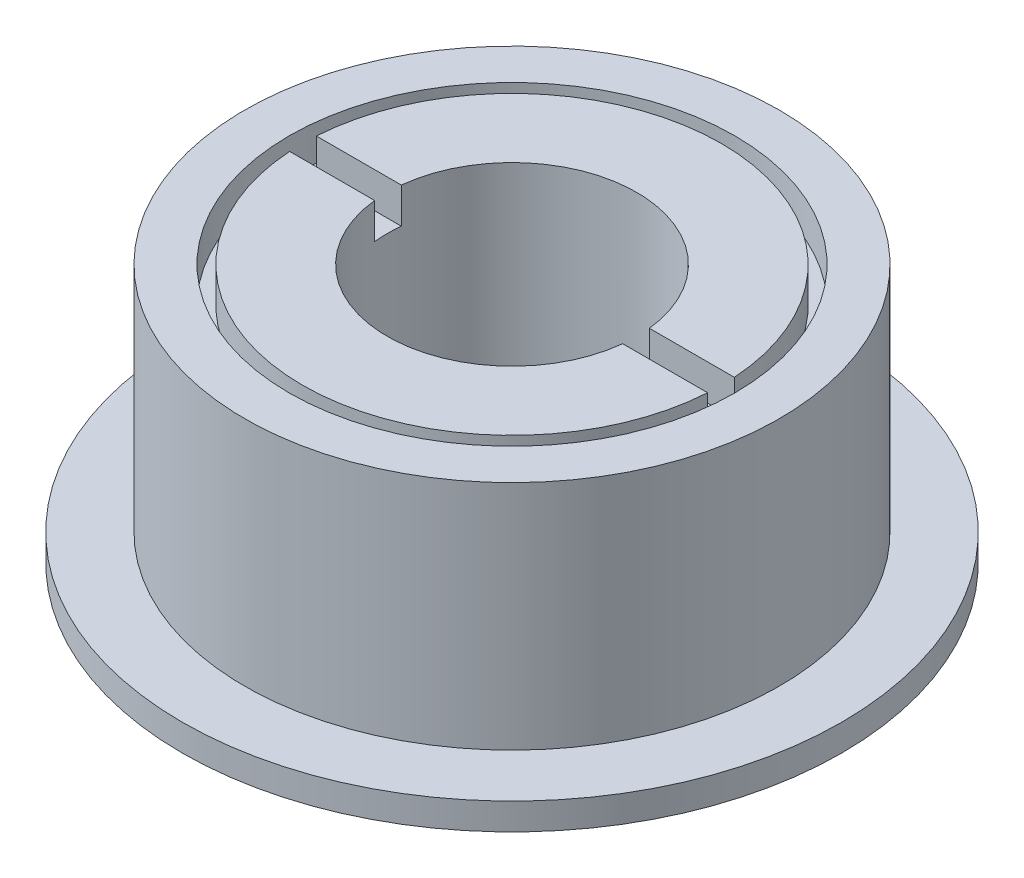
from build123d import *

# Parameters (mm, degrees)
SKETCH1_R           = 37
BOSS_EXTRUDE1_DEPTH = 3
SKETCH1_3_R         = 30
SKETCH1_3_R_2       = 14
BOSS_EXTRUDE2_DEPTH = 29
CUT_EXTRUDE1_START  = -4
SKETCH2_R           = 25
SKETCH2_R_2         = 23.5
CUT_EXTRUDE1_DEPTH  = 4
SKETCH3_R           = 4
SKETCH3_R_2         = 2
CUT_EXTRUDE2_DEPTH  = 4


with BuildPart() as part:
    # Sketch1 → Boss-Extrude1 (new body)
    with BuildSketch(Plane(origin=(0, 0, 0), x_dir=(1, 0, 0), z_dir=(0, 1, 0))):
        with Locations(Location((0, 0, 0), (0, 0, 270))):
            Circle(SKETCH1_R)
    extrude(amount=BOSS_EXTRUDE1_DEPTH)

    # Sketch1<3> → Boss-Extrude2 (add)
    with BuildSketch(Plane(origin=(0, 0, 0), x_dir=(1, 0, 0), z_dir=(0, 1, 0))):
        with Locations(Location((0, 0, 0), (0, 0, 90))):
            Circle(SKETCH1_3_R)
        with Locations(Location((0, 0, 0), (0, 0, 90))):
            Circle(SKETCH1_3_R_2, mode=Mode.SUBTRACT)
    extrude(amount=BOSS_EXTRUDE2_DEPTH)

    # Sketch2 → Cut-Extrude1 (cut)
    # profile 1 of 10: a face of its own
    with BuildSketch(Plane(origin=(0, 29, 0), x_dir=(1, 0, 0), z_dir=(0, 1, 0)).offset(CUT_EXTRUDE1_START)):
        with Locations(Location((0, 0, 0), (0, 0, 270))):
            Circle(SKETCH2_R)
        Circle(SKETCH2_R_2, mode=Mode.SUBTRACT)
    # profile 2 of 10: a face of its own
    with BuildSketch(Plane(origin=(0, 29, 0), x_dir=(1, 0, 0), z_dir=(0, 1, 0)).offset(CUT_EXTRUDE1_START)):
        with BuildLine():
            ThreePointArc((24.954959427, 1.5), (0, 25), (-24.954959427, 1.5))
            Line((-24.954959427, 1.5), (-23.452078799, 1.5))
            ThreePointArc((-23.452078799, 1.5), (0, 23.5), (23.452078799, 1.5))
            Line((23.452078799, 1.5), (24.954959427, 1.5))
        make_face()
    # profile 3 of 10: a face of its own
    with BuildSketch(Plane(origin=(0, 29, 0), x_dir=(1, 0, 0), z_dir=(0, 1, 0)).offset(CUT_EXTRUDE1_START)):
        with BuildLine():
            ThreePointArc((-24.954959427, 1.5), (-25, 0), (-24.954959427, -1.5))
            Line((-24.954959427, -1.5), (-23.452078799, -1.5))
            ThreePointArc((-23.452078799, -1.5), (-23.5, 0), (-23.452078799, 1.5))
            Line((-23.452078799, 1.5), (-24.954959427, 1.5))
        make_face()
    # profile 4 of 10: a face of its own
    with BuildSketch(Plane(origin=(0, 29, 0), x_dir=(1, 0, 0), z_dir=(0, 1, 0)).offset(CUT_EXTRUDE1_START)):
        with BuildLine():
            Line((23.452078799, -1.5), (24.954959427, -1.5))
            ThreePointArc((24.954959427, -1.5), (24.98873732, -0.750338033), (25, 0))
            ThreePointArc((25, 0), (24.98873732, 0.750338033), (24.954959427, 1.5))
            Line((24.954959427, 1.5), (23.452078799, 1.5))
            ThreePointArc((23.452078799, 1.5), (23.488016644, 0.750382643), (23.5, 0))
            ThreePointArc((23.5, 0), (23.488016644, -0.750382643), (23.452078799, -1.5))
        make_face()
    # profile 5 of 10: a face of its own
    with BuildSketch(Plane(origin=(0, 29, 0), x_dir=(1, 0, 0), z_dir=(0, 1, 0)).offset(CUT_EXTRUDE1_START)):
        with BuildLine():
            ThreePointArc((-23.452078799, 1.5), (-23.5, 0), (-23.452078799, -1.5))
            Line((-23.452078799, -1.5), (-13.919410907, -1.5))
            ThreePointArc((-13.919410907, -1.5), (-14, 0), (-13.919410907, 1.5))
            Line((-13.919410907, 1.5), (-23.452078799, 1.5))
        make_face()
    # profile 6 of 10: a face of its own
    with BuildSketch(Plane(origin=(0, 29, 0), x_dir=(1, 0, 0), z_dir=(0, 1, 0)).offset(CUT_EXTRUDE1_START)):
        with BuildLine():
            Line((13.919410907, -1.5), (23.452078799, -1.5))
            ThreePointArc((23.452078799, -1.5), (23.488016644, -0.750382643), (23.5, 0))
            ThreePointArc((23.5, 0), (23.488016644, 0.750382643), (23.452078799, 1.5))
            Line((23.452078799, 1.5), (13.919410907, 1.5))
            ThreePointArc((13.919410907, 1.5), (13.979838209, 0.751081654), (14, 0))
            ThreePointArc((14, 0), (13.979838209, -0.751081654), (13.919410907, -1.5))
        make_face()
    # profile 7 of 10: a face of its own
    with BuildSketch(Plane(origin=(0, 29, 0), x_dir=(1, 0, 0), z_dir=(0, 1, 0)).offset(CUT_EXTRUDE1_START)):
        with BuildLine():
            ThreePointArc((-23.452078799, 1.5), (-23.5, 0), (-23.452078799, -1.5))
            Line((-23.452078799, -1.5), (-13.919410907, -1.5))
            ThreePointArc((-13.919410907, -1.5), (-14, 0), (-13.919410907, 1.5))
            Line((-13.919410907, 1.5), (-23.452078799, 1.5))
        make_face()
    # profile 8 of 10: a face of its own
    with BuildSketch(Plane(origin=(0, 29, 0), x_dir=(1, 0, 0), z_dir=(0, 1, 0)).offset(CUT_EXTRUDE1_START)):
        with BuildLine():
            Line((13.919410907, -1.5), (23.452078799, -1.5))
            ThreePointArc((23.452078799, -1.5), (23.488016644, -0.750382643), (23.5, 0))
            ThreePointArc((23.5, 0), (23.488016644, 0.750382643), (23.452078799, 1.5))
            Line((23.452078799, 1.5), (13.919410907, 1.5))
            ThreePointArc((13.919410907, 1.5), (13.979838209, 0.751081654), (14, 0))
            ThreePointArc((14, 0), (13.979838209, -0.751081654), (13.919410907, -1.5))
        make_face()
    # profile 9 of 10: a face of its own
    with BuildSketch(Plane(origin=(0, 29, 0), x_dir=(1, 0, 0), z_dir=(0, 1, 0)).offset(CUT_EXTRUDE1_START)):
        with BuildLine():
            ThreePointArc((-24.954959427, 1.5), (-25, 0), (-24.954959427, -1.5))
            Line((-24.954959427, -1.5), (-23.452078799, -1.5))
            ThreePointArc((-23.452078799, -1.5), (-23.5, 0), (-23.452078799, 1.5))
            Line((-23.452078799, 1.5), (-24.954959427, 1.5))
        make_face()
    # profile 10 of 10: a face of its own
    with BuildSketch(Plane(origin=(0, 29, 0), x_dir=(1, 0, 0), z_dir=(0, 1, 0)).offset(CUT_EXTRUDE1_START)):
        with BuildLine():
            Line((23.452078799, -1.5), (24.954959427, -1.5))
            ThreePointArc((24.954959427, -1.5), (24.98873732, -0.750338033), (25, 0))
            ThreePointArc((25, 0), (24.98873732, 0.750338033), (24.954959427, 1.5))
            Line((24.954959427, 1.5), (23.452078799, 1.5))
            ThreePointArc((23.452078799, 1.5), (23.488016644, 0.750382643), (23.5, 0))
            ThreePointArc((23.5, 0), (23.488016644, -0.750382643), (23.452078799, -1.5))
        make_face()
    extrude(amount=CUT_EXTRUDE1_DEPTH, mode=Mode.SUBTRACT)

    # Sketch3 → Cut-Extrude2 (cut)
    with BuildSketch(Plane.XZ):
        with Locations(Location((0, 0, 0), (0, 0, 270))):
            Circle(SKETCH3_R)
        with Locations(Location((-8, 0, 0), (0, 0, 270))):
            Circle(SKETCH3_R_2)
        with Locations(Location((0, 8, 0), (0, 0, 270))):
            Circle(SKETCH3_R_2)
        with Locations(Location((8, 0, 0), (0, 0, 270))):
            Circle(SKETCH3_R_2)
        with Locations(Location((0, -8, 0), (0, 0, 270))):
            Circle(SKETCH3_R_2)
    extrude(amount=-CUT_EXTRUDE2_DEPTH, mode=Mode.SUBTRACT)


solid = part.part
